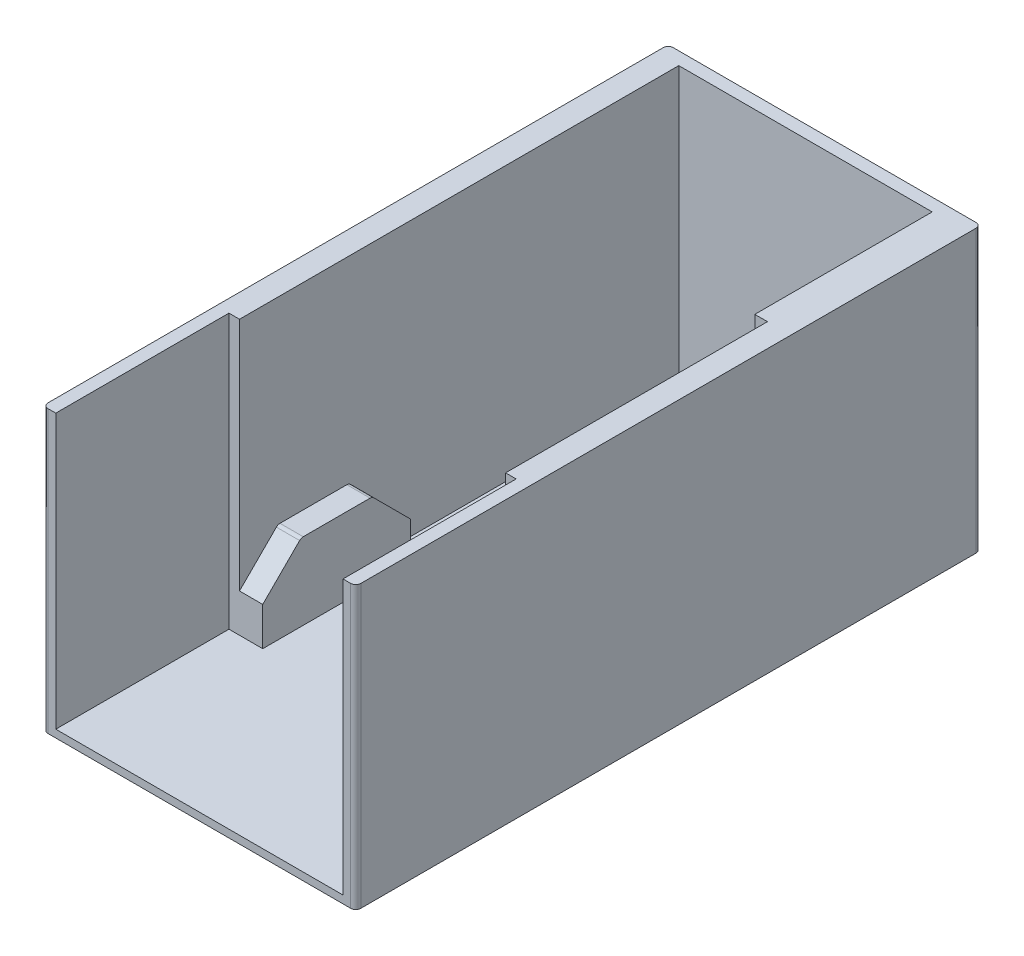
from build123d import *

# Parameters (mm, degrees)
BOSS_EXTRUDE1_DEPTH = 107
SKETCH7_W           = 122.268
SKETCH7_H           = 249.395
BOSS_EXTRUDE2_DEPTH = 3
SKETCH8_W           = 9.0805
SKETCH8_H           = 57.785
BOSS_EXTRUDE3_DEPTH = 30
CUT_EXTRUDE1_DEPTH  = 9.0805
CUT_EXTRUDE2_DEPTH  = 9.0805
FILLET1_R           = 2
CUT_EXTRUDE3_DEPTH  = 3271.793089872


with BuildPart() as part:
    # Sketch6 → Boss-Extrude1 (new body)
    with BuildSketch(Plane(origin=(0, 0, 0), x_dir=(1, 0, 0), z_dir=(0, 1, 0))):
        Polygon((-809.2275, 2922.905), (-804.2275, 2922.905), (-804.2275, 2990.596), (-800.1, 2990.596), (-800.1, 3162.3), (-701.04, 3162.3), (-701.04, 3092.958), (-696.087, 3092.958), (-696.087, 2990.596), (-691.9595, 2990.596), (-691.9595, 2922.905), (-686.9595, 2922.905), (-686.9595, 3167.3), (-809.2275, 3167.3), align=None)
    extrude(amount=BOSS_EXTRUDE1_DEPTH)

    # Sketch7 → Boss-Extrude2 (add)
    with BuildSketch(Plane.XZ):
        with Locations((-748.0935, -3042.6025)):
            Rectangle(SKETCH7_W, SKETCH7_H)
    extrude(amount=BOSS_EXTRUDE2_DEPTH)

    # Sketch8 → Boss-Extrude3 (add)
    with BuildSketch(Plane(origin=(0, 0, 0), x_dir=(1, 0, 0), z_dir=(0, 1, 0))):
        with Locations((-795.55975, 3019.4885)):
            Rectangle(SKETCH8_W, SKETCH8_H)
        with Locations((-700.62725, 3019.4885)):
            Rectangle(SKETCH8_W, SKETCH8_H)
    extrude(amount=BOSS_EXTRUDE3_DEPTH)

    # Sketch9 → Cut-Extrude1 (cut)
    with BuildSketch(Plane(origin=(-791.0195, 0, 0), x_dir=(0, 0, -1), z_dir=(1, 0, 0))):
        Polygon((2990.596, 30), (2990.596, 15), (3005.596, 30), align=None)
        Polygon((3048.381, 30), (3033.381, 30), (3048.381, 15), align=None)
    extrude(amount=-CUT_EXTRUDE1_DEPTH, mode=Mode.SUBTRACT)

    # Sketch10 → Cut-Extrude2 (cut)
    with BuildSketch(Plane.ZY.offset(705.1675)):
        Polygon((-3048.381, 30), (-3048.381, 15), (-3033.381, 30), align=None)
        Polygon((-2990.596, 30), (-3005.596, 30), (-2990.596, 15), align=None)
    extrude(amount=-CUT_EXTRUDE2_DEPTH, mode=Mode.SUBTRACT)

    # Fillet1
    fillet1_edges = [part.edges().sort_by_distance(p)[0] for p in [
        (-795.55975, 30, -3005.596),
        (-795.55975, 30, -3033.381),
        (-700.62725, 30, -3033.381),
        (-700.62725, 30, -3005.596),
        (-809.2275, 53.5, -2922.905),
        (-809.2275, 52, -3167.3),
        (-686.9595, 52, -3167.3),
        (-686.9595, 53.5, -2922.905),
    ]]
    fillet(fillet1_edges, radius=FILLET1_R)

    # Sketch11 → Cut-Extrude3 (cut, through all)
    with BuildSketch(Plane(origin=(0, 0, 0), x_dir=(-1, 0, 0), z_dir=(0, 1, 0))):
        with BuildLine():
            Line((804.2275, -2922.905), (691.9595, -2922.905))
            Line((691.9595, -2922.905), (688.9595, -2922.905))
            ThreePointArc((688.9595, -2922.905), (687.545286438, -2923.490786438), (686.9595, -2924.905))
            Line((686.9595, -2924.905), (686.9595, -2917.905))
            Line((686.9595, -2917.905), (809.2275, -2917.905))
            Line((809.2275, -2917.905), (809.2275, -2924.905))
            ThreePointArc((809.2275, -2924.905), (808.641713562, -2923.490786438), (807.2275, -2922.905))
            Line((807.2275, -2922.905), (804.2275, -2922.905))
        make_face()
    extrude(amount=-CUT_EXTRUDE3_DEPTH, mode=Mode.SUBTRACT)


solid = part.part
